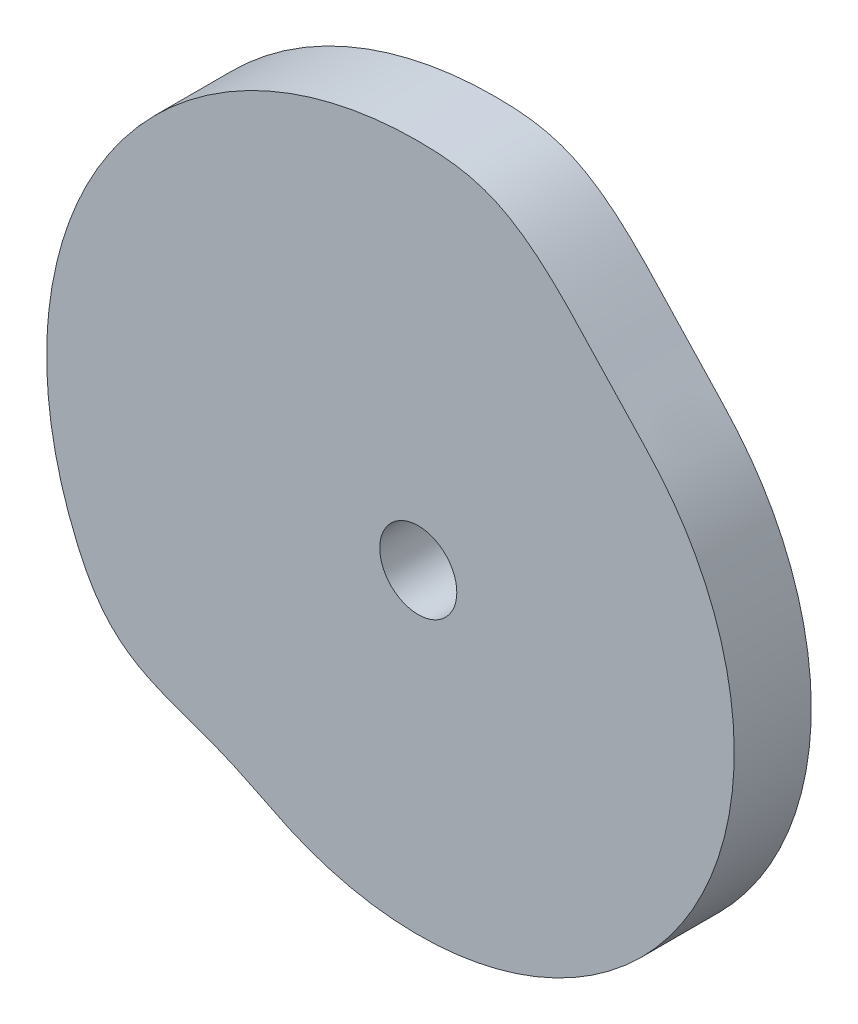
from build123d import *

# Parameters (mm, degrees)
SKETCH_1_R      = 10
EXTRUDE_1_DEPTH = 20


with BuildPart() as part:
    # 草图1 → 凸台-拉伸1 (new body)
    with BuildSketch(Plane.XY):
        with BuildLine():
            add(Edge.make_bspline(
                [(-96.4192, 2.2065), (-96.4256097, 1.92602417), (-96.436000414, 1.365018538), (-96.444383754, 0.523420306), (-96.445064054, -0.31821192), (-96.438759859, -1.159811274), (-96.424896481, -2.001341993), (-96.403852473, -2.842709617), (-96.37529793, -3.683872168), (-96.33955043, -4.524741272), (-96.296303124, -5.365302819), (-96.245826674, -6.205435948), (-96.188006636, -7.045099776), (-96.122943706, -7.884204265), (-96.050414521, -8.722731618), (-95.970587329, -9.560590416), (-95.883653194, -10.397736534), (-95.789200103, -11.234059592), (-95.68753427, -12.069529427), (-95.578480371, -12.904083402), (-95.462327614, -13.737659863), (-95.338821493, -14.570192078), (-95.207980047, -15.401612378), (-95.070036612, -16.231893216), (-94.924691106, -17.060912284), (-94.77220678, -17.888614061), (-94.612498039, -18.714945056), (-94.445587103, -19.539875335), (-94.271520335, -20.363315336), (-94.090186703, -21.185207795), (-93.901684894, -22.005465714), (-93.706088871, -22.824065879), (-93.503390945, -23.640941215), (-93.293489207, -24.455999031), (-93.076472857, -25.269185209), (-92.852473313, -26.080460729), (-92.621379982, -26.889763017), (-92.383169449, -27.697016706), (-92.138002064, -28.502170853), (-91.885633831, -29.3050621), (-91.626452596, -30.105811687), (-91.360299851, -30.904262013), (-91.087021114, -31.700324142), (-90.806958897, -32.494004183), (-90.519962365, -33.285206507), (-90.226030934, -34.073862393), (-89.925246248, -34.859923055), (-89.617622171, -35.643347487), (-89.303267353, -36.424080965), (-88.981896141, -37.20195876), (-88.654042762, -37.97686034), (-88.320017192, -38.747218226), (-87.981090891, -39.510581098), (-87.638000753, -40.264165238), (-87.290577537, -41.006151737), (-86.938702023, -41.735988711), (-86.581982957, -42.453449837), (-86.220017068, -43.158167482), (-85.852452539, -43.849947375), (-85.479076315, -44.52851969), (-85.099456031, -45.193708214), (-84.71356759, -45.845454301), (-84.320832377, -46.483539127), (-83.921272849, -47.107959063), (-83.514667883, -47.71873078), (-83.100584341, -48.315666744), (-82.679215869, -48.899098963), (-82.250029384, -49.468775041), (-81.8130492, -50.024922015), (-81.368014685, -50.56757462), (-80.915075288, -51.097132757), (-80.453691621, -51.613414796), (-79.983999687, -52.116815334), (-79.50573714, -52.607351056), (-79.018994281, -53.085409547), (-78.52338938, -53.550895147), (-78.019164166, -54.004405745), (-77.505955583, -54.445812466), (-76.983891882, -54.875527619), (-76.452912608, -55.29376076), (-75.91291106, -55.700645982), (-75.363953444, -56.096497382), (-74.806093592, -56.481582967), (-74.239282413, -56.85599171), (-73.663688807, -57.220278088), (-73.079280421, -57.574537346), (-72.486164153, -57.919184233), (-71.884438773, -58.254462089), (-71.27414606, -58.580715094), (-70.655529363, -58.898522681), (-70.028594756, -59.208000355), (-69.393634952, -59.509941322), (-68.75055839, -59.804402845), (-68.099684878, -60.092359208), (-67.441039344, -60.374068505), (-66.774838737, -60.65017426), (-66.101200069, -60.921272521), (-65.420318864, -61.188070627), (-64.732305308, -61.451181492), (-64.037322645, -61.711204913), (-63.335626536, -61.969176193), (-62.627266138, -62.22536289), (-61.912609512, -62.480962539), (-61.191898475, -62.736555619), (-60.465305408, -62.992704627), (-59.733234726, -63.250348026), (-58.9960566, -63.510233056), (-58.254153158, -63.772884502), (-57.507972284, -64.039073637), (-56.757978739, -64.309304028), (-56.00475391, -64.584209023), (-55.248797627, -64.864073377), (-54.490732338, -65.149449297), (-53.731170909, -65.440613986), (-52.970827185, -65.737851181), (-52.210199073, -66.041033495), (-51.450034035, -66.350445918), (-50.690857068, -66.665864897), (-49.933324093, -66.987222519), (-49.177887674, -67.314168801), (-48.425039923, -67.646388534), (-47.675346296, -67.983698106), (-46.929063353, -68.325343837), (-46.186643122, -68.671089382), (-45.448210726, -69.020060968), (-44.714065188, -69.371767957), (-43.984368191, -69.725598835), (-43.259320669, -70.080922572), (-42.538871466, -70.436834581), (-41.823313726, -70.792925849), (-41.112393242, -71.148019991), (-40.406378775, -71.501757844), (-39.705244132, -71.853354382), (-39.008906275, -72.201779953), (-38.317438969, -72.546382296), (-37.6310116, -72.886704793), (-36.949469366, -73.221637698), (-36.272903828, -73.550563594), (-35.601537575, -73.872938039), (-34.935342509, -74.187796768), (-34.274297643, -74.494673565), (-33.617062236, -74.793442112), (-32.961252902, -75.084754406), (-32.304510526, -75.369623263), (-31.645615273, -75.648818295), (-30.984184598, -75.921921846), (-30.320491359, -76.189476008), (-29.654459623, -76.451170168), (-28.986208742, -76.707067319), (-28.315706937, -76.957084228), (-27.643104222, -77.201291205), (-26.968309916, -77.439467396), (-26.291531811, -77.671882279), (-25.612724984, -77.898416383), (-24.931934856, -78.118863297), (-24.249280595, -78.333484095), (-23.564821333, -78.542237854), (-22.878480948, -78.744750556), (-22.190468453, -78.941555816), (-21.5007055, -79.132065642), (-20.809326485, -79.316722632), (-20.116399358, -79.495293497), (-19.421916332, -79.667842598), (-18.725933398, -79.834185122), (-18.028554142, -79.994616229), (-17.329793186, -80.148917563), (-16.62974354, -80.297141555), (-15.928358722, -80.439090069), (-15.225820307, -80.575138007), (-14.522090957, -80.704933344), (-13.817255279, -80.828521335), (-13.11135885, -80.946003332), (-12.404485001, -81.057469452), (-11.696636678, -81.162498107), (-10.987953629, -81.261540196), (-10.278424698, -81.35433085), (-9.568098561, -81.440942437), (-8.857035168, -81.521316672), (-8.145283606, -81.595577524), (-7.432908011, -81.663385414), (-6.719994267, -81.725270941), (-6.006560293, -81.780726939), (-5.292667047, -81.830028434), (-4.578376643, -81.873159134), (-3.863745803, -81.90992834), (-3.148819172, -81.94052833), (-2.433627265, -81.964964114), (-1.718264651, -81.98301571), (-1.002772071, -81.994967479), (-0.28721075, -82.0005171), (0.428383186, -81.999964278), (1.143943379, -81.993026332), (1.859403262, -81.979928145), (2.574732701, -81.960663725), (3.289857113, -81.935017072), (4.004754619, -81.903263325), (4.719345325, -81.865128742), (5.43357191, -81.82082702), (6.147371153, -81.77036288), (6.860693159, -81.71352523), (7.573520603, -81.650530643), (8.285781933, -81.581337719), (8.997408776, -81.505933123), (9.708303513, -81.424338544), (10.418462787, -81.336526176), (11.127857335, -81.242529439), (11.836419987, -81.142340989), (12.544080096, -81.035933229), (13.250732508, -80.923314816), (13.956402964, -80.804638103), (14.660986512, -80.679710002), (15.364481526, -80.548716493), (16.066820029, -80.411636828), (16.767905403, -80.268322786), (17.467716309, -80.118880863), (18.166241398, -79.963551091), (18.863352326, -79.801906946), (19.559036974, -79.634200441), (20.253233133, -79.460507823), (20.945901385, -79.280800969), (21.636972233, -79.095032537), (22.326336647, -78.903089228), (23.014037576, -78.705279236), (23.699977264, -78.501516525), (24.384131838, -78.291691475), (25.066413004, -78.075880815), (25.746810028, -77.854187398), (26.425254561, -77.626600046), (27.101635945, -77.392990534), (27.77594135, -77.153459023), (28.448188668, -76.908176805), (29.118241249, -76.65698311), (29.786090585, -76.399949952), (30.451668647, -76.1371889), (31.114912915, -75.868543175), (31.775795887, -75.594190723), (32.434218781, -75.313929599), (33.09022348, -75.028050074), (33.743722187, -74.73645484), (34.394649301, -74.439147908), (35.042923595, -74.136133705), (35.688579529, -73.827553536), (36.331427008, -73.513218971), (36.971581751, -73.19343521), (37.608900928, -72.868012186), (38.24336223, -72.537040005), (38.874906989, -72.200503323), (39.503461208, -71.858519076), (40.12906464, -71.511121147), (40.75148386, -71.158081952), (41.370936593, -70.799787443), (41.987229576, -70.436133357), (42.60024917, -70.06693622), (43.210134627, -69.692623993), (43.816661381, -69.312861488), (44.41988004, -68.927891818), (45.019621303, -68.537569704), (45.616028299, -68.142164794), (46.208864421, -67.741437761), (46.798317646, -67.335681876), (47.384069187, -66.924631879), (47.966333021, -66.508641914), (48.544898937, -66.087528153), (49.11984952, -65.66146151), (49.690905606, -65.230223906), (50.258232679, -64.794115559), (50.821781183, -64.353099972), (51.381427604, -63.907138653), (51.937145059, -63.456276932), (52.489000054, -63.000746984), (53.036653247, -62.540136275), (53.580472872, -62.075035222), (54.120085686, -61.605069282), (54.655614376, -61.130460945), (55.18699212, -60.651166022), (55.714210159, -60.16728153), (56.237103391, -59.678767049), (56.755715882, -59.185706969), (57.270143612, -58.688299166), (57.780010982, -58.18619274), (58.285683131, -57.67985948), (58.786693339, -57.168932489), (59.28337877, -56.653779779), (59.775570465, -56.134361157), (60.263047504, -55.610473661), (60.746081135, -55.082498879), (61.22445452, -54.550301748), (61.698217704, -54.013987269), (62.167151728, -53.473461072), (62.631533242, -52.929017636), (63.090861232, -52.380332298), (63.545627028, -51.827846699), (63.995539308, -51.271347578), (64.44047591, -50.710888479), (64.880534103, -50.146581644), (65.315752836, -49.578570987), (65.745812811, -49.006589682), (66.171016669, -48.431042562), (66.59120154, -47.85180241), (67.006101552, -47.268774466), (67.416183505, -46.682312391), (67.820953815, -46.092191307), (68.22055398, -45.498592061), (68.614976967, -44.901519939), (69.004275851, -44.301118008), (69.38818611, -43.697216074), (69.766890511, -43.090041299), (70.140287758, -42.479561053), (70.508273995, -41.865854279), (70.870928593, -41.248968789), (71.22819479, -40.628955964), (71.579982942, -40.005799598), (71.926448434, -39.379689813), (72.267301033, -38.750499305), (72.602713794, -38.118375912), (72.932651732, -37.483381727), (73.256906261, -36.845444614), (73.575743704, -36.204799456), (73.88882702, -35.561344406), (74.196347299, -34.915224323), (74.498239634, -34.266439716), (74.794482065, -33.615043342), (75.084829049, -32.96099351), (75.369631771, -32.304514305), (75.648816015, -31.64561426), (75.921922457, -30.984184869), (76.189475844, -30.320491286), (76.451170211, -29.654459642), (76.707067307, -28.986208737), (76.957084232, -28.315706939), (77.201291204, -27.643104221), (77.439467396, -26.968309916), (77.671882279, -26.291531811), (77.898416383, -25.612724984), (78.118863297, -24.931934856), (78.333484095, -24.249280595), (78.542237854, -23.564821333), (78.744750556, -22.878480948), (78.941555816, -22.190468453), (79.132065642, -21.5007055), (79.316722632, -20.809326485), (79.495293497, -20.116399358), (79.667842598, -19.421916332), (79.834185122, -18.725933398), (79.994616229, -18.028554142), (80.148917563, -17.329793186), (80.297141555, -16.62974354), (80.439090069, -15.928358722), (80.575138007, -15.225820307), (80.704933344, -14.522090957), (80.828521335, -13.817255279), (80.946003332, -13.11135885), (81.057469452, -12.404485001), (81.162498107, -11.696636678), (81.261540196, -10.987953629), (81.35433085, -10.278424698), (81.440942437, -9.568098561), (81.521316672, -8.857035168), (81.595577524, -8.145283606), (81.663385414, -7.432908011), (81.725270941, -6.719994267), (81.780726939, -6.006560293), (81.830028434, -5.292667047), (81.873159134, -4.578376643), (81.90992834, -3.863745803), (81.94052833, -3.148819172), (81.964964114, -2.433627265), (81.98301571, -1.718264651), (81.994967479, -1.002772071), (82.0005171, -0.28721075), (81.999964278, 0.428383186), (81.993026332, 1.143943379), (81.979928145, 1.859403262), (81.960663725, 2.574732701), (81.935017072, 3.289857113), (81.903263325, 4.004754619), (81.865128742, 4.719345325), (81.82082702, 5.43357191), (81.77036288, 6.147371153), (81.71352523, 6.860693159), (81.650530643, 7.573520603), (81.581337719, 8.285781933), (81.505933123, 8.997408776), (81.424338544, 9.708303513), (81.336526176, 10.418462787), (81.242529439, 11.127857335), (81.142340989, 11.836419987), (81.035933229, 12.544080096), (80.923314816, 13.250732508), (80.804638103, 13.956402964), (80.679710002, 14.660986512), (80.548716493, 15.364481526), (80.411636828, 16.066820029), (80.268322786, 16.767905403), (80.118880863, 17.467716309), (79.963551091, 18.166241398), (79.801906946, 18.863352326), (79.634200441, 19.559036974), (79.460507823, 20.253233133), (79.280800969, 20.945901385), (79.095032537, 21.636972233), (78.903089228, 22.326336647), (78.705279236, 23.014037576), (78.501516525, 23.699977264), (78.291691475, 24.384131838), (78.075880815, 25.066413004), (77.854187398, 25.746810028), (77.626600046, 26.425254561), (77.392990534, 27.101635945), (77.153459023, 27.77594135), (76.908176805, 28.448188668), (76.65698311, 29.118241249), (76.399949952, 29.786090585), (76.1371889, 30.451668647), (75.868543175, 31.114912915), (75.594190723, 31.775795887), (75.313929599, 32.434218781), (75.028050074, 33.09022348), (74.73645484, 33.743722187), (74.439147908, 34.394649301), (74.136133705, 35.042923595), (73.827553536, 35.688579529), (73.513218971, 36.331427008), (73.19343521, 36.971581751), (72.868012186, 37.608900928), (72.537040005, 38.24336223), (72.200503323, 38.874906989), (71.858519076, 39.503461208), (71.511121147, 40.12906464), (71.158081952, 40.75148386), (70.799787443, 41.370936593), (70.436133357, 41.987229576), (70.06693622, 42.60024917), (69.692623993, 43.210134627), (69.312861488, 43.816661381), (68.927891818, 44.41988004), (68.537569704, 45.019621303), (68.142164794, 45.616028299), (67.741437761, 46.208864421), (67.335681876, 46.798317646), (66.924631879, 47.384069187), (66.508641914, 47.966333021), (66.087528153, 48.544898938), (65.661461508, 49.119849518), (65.230223912, 49.690905611), (64.794115534, 50.258232658), (64.353100065, 50.821781262), (63.907138309, 51.38142731), (63.456278215, 51.937146157), (63.000742196, 52.488995957), (62.540002894, 53.036848386), (62.073508371, 53.582121013), (61.599230775, 54.126799811), (61.1155936, 54.673324035), (60.622056862, 55.223558711), (60.118576899, 55.777981778), (59.605409638, 56.337048404), (59.083077854, 56.901270543), (58.551782525, 57.47092773), (58.011952664, 58.046282311), (57.464067985, 58.627774979), (56.908466106, 59.215549999), (56.345572219, 59.809863209), (55.775748402, 60.410780955), (55.199447928, 61.018455859), (54.617208, 61.633084905), (54.029236124, 62.25451718), (53.435848958, 62.882672656), (52.837617518, 63.51777344), (52.234566544, 64.159397414), (51.627268084, 64.807727029), (51.01557083, 65.462141878), (50.400254775, 66.12294788), (49.780958486, 66.789356917), (49.158187144, 67.461382037), (48.53202597, 68.138582719), (47.902564956, 68.820583221), (47.269964886, 69.506972888), (46.63412738, 70.197230481), (45.995322042, 70.890915048), (45.353541262, 71.587458358), (44.7088936, 72.286299345), (44.06136995, 72.986799213), (43.411022273, 73.688342272), (42.757915988, 74.390196507), (42.102204564, 75.091806333), (41.443660314, 75.792131546), (40.78270389, 76.490769972), (40.119193487, 77.186695493), (39.453193735, 77.879103788), (38.784831182, 78.567187691), (38.114189451, 79.250131355), (37.44149759, 79.927131948), (36.76661641, 80.597149931), (36.090025153, 81.259602874), (35.411477845, 81.91333939), (34.73129528, 82.55772009), (34.049524922, 83.191783571), (33.366504738, 83.814991091), (32.68207327, 84.426138585), (31.996791369, 85.025049071), (31.310380173, 85.610509825), (30.62330733, 86.182289975), (29.935384706, 86.739354921), (29.247093359, 87.281606823), (28.558303588, 87.808207586), (27.869227095, 88.31899886), (27.179783847, 88.813323822), (26.490215376, 89.291168575), (25.800445456, 89.752150084), (25.110461149, 90.196041043), (24.420207767, 90.622841322), (23.729656987, 91.032496493), (23.038571231, 91.424943983), (22.346989697, 91.800433744), (21.654520396, 92.158805182), (20.961053485, 92.500390072), (20.266170365, 92.825204554), (19.569762965, 93.133787105), (18.871343621, 93.426141961), (18.17054983, 93.702575975), (17.466975373, 93.963366725), (16.760248637, 94.208889695), (16.049899558, 94.439368249), (15.335521865, 94.655202899), (14.616681926, 94.856827525), (13.892873401, 95.044164878), (13.163740079, 95.21807134), (12.428778193, 95.378368477), (11.687679008, 95.525908884), (10.940031813, 95.660681773), (10.18546441, 95.782944304), (9.423719259, 95.893563462), (8.654414209, 95.992413593), (7.877310775, 96.080288376), (7.092158938, 96.157202945), (6.29874266, 96.224076325), (5.496883409, 96.280889077), (4.686379154, 96.328504954), (3.867179164, 96.36721657), (3.039365018, 96.397880756), (2.204348612, 96.420403713), (1.364785653, 96.4360167), (0.523420199, 96.444380012), (-0.318211891, 96.445065057), (-1.159811281, 96.43875959), (-2.00134199, 96.424896553), (-2.842709618, 96.403852454), (-3.683872168, 96.375297935), (-4.524741272, 96.339550429), (-5.365302819, 96.296303124), (-6.205435948, 96.245826674), (-7.045099776, 96.188006636), (-7.884204265, 96.122943706), (-8.722731618, 96.050414521), (-9.560590416, 95.970587329), (-10.397736534, 95.883653194), (-11.234059592, 95.789200103), (-12.069529427, 95.68753427), (-12.904083402, 95.578480371), (-13.737659863, 95.462327614), (-14.570192078, 95.338821493), (-15.401612378, 95.207980047), (-16.231893216, 95.070036612), (-17.060912284, 94.924691106), (-17.888614061, 94.77220678), (-18.714945056, 94.612498039), (-19.539875335, 94.445587103), (-20.363315336, 94.271520335), (-21.185207795, 94.090186703), (-22.005465714, 93.901684894), (-22.824065879, 93.706088871), (-23.640941215, 93.503390945), (-24.455999031, 93.293489207), (-25.269185209, 93.076472857), (-26.080460729, 92.852473313), (-26.889763017, 92.621379982), (-27.697016705, 92.383169449), (-28.502170853, 92.138002064), (-29.3050621, 91.885633831), (-30.105811687, 91.626452596), (-30.904262013, 91.360299851), (-31.700324142, 91.087021114), (-32.494004182, 90.806958895), (-33.28520651, 90.519962372), (-34.073862383, 90.226030909), (-34.859923095, 89.92524634), (-35.643347337, 89.617621828), (-36.424081523, 89.303268635), (-37.201956676, 88.981891356), (-37.977073744, 88.65397362), (-38.749216348, 88.319070502), (-39.518484534, 87.977646234), (-40.284730744, 87.629396202), (-41.047895577, 87.274521574), (-41.80791895, 86.912996672), (-42.564780213, 86.544914748), (-43.318350724, 86.170050484), (-44.068725965, 85.788828845), (-44.815668604, 85.400976402), (-45.559198868, 85.006665586), (-46.299304831, 84.605870668), (-47.035874098, 84.198601541), (-47.768790222, 83.784839788), (-48.498150229, 83.364847386), (-49.223806183, 82.938455965), (-49.945728995, 82.505786055), (-50.663746709, 82.066678922), (-51.378070274, 81.621583297), (-52.088324964, 81.170017938), (-52.794693624, 80.712432261), (-53.496986654, 80.248596463), (-54.195251684, 79.778720861), (-54.889443925, 79.302830555), (-55.579280087, 78.820682398), (-56.265003441, 78.332662703), (-56.94653071, 77.838849251), (-57.62353426, 77.338842222), (-58.296268979, 76.83307971), (-58.964503747, 76.321352782), (-59.628399642, 75.803999124), (-60.287513352, 75.280638426), (-60.942217662, 74.751750602), (-61.592162532, 74.217039613), (-62.237491342, 73.676725006), (-62.878105899, 73.130831714), (-63.513894146, 72.579340496), (-64.14482384, 72.022288159), (-64.770902729, 71.459824747), (-65.392061365, 70.891907039), (-66.008121084, 70.31848307), (-66.619248299, 69.739766332), (-67.225332851, 69.155806754), (-67.826280568, 68.566542352), (-68.422077132, 67.972092905), (-69.012563037, 67.372334391), (-69.597890421, 66.76754923), (-70.177882234, 66.157661614), (-70.752492879, 65.542697302), (-71.321835069, 64.92285318), (-71.885569233, 64.297887552), (-72.444048364, 63.668240946), (-72.996815447, 63.0335734), (-73.544152919, 62.394192295), (-74.085812726, 61.750010802), (-74.621849836, 61.101139966), (-75.1522999, 60.447692277), (-75.676792271, 59.789439474), (-76.195822977, 59.126886597), (-76.708732747, 58.459592012), (-77.216097959, 57.788077424), (-77.717393235, 57.112008071), (-78.2127935, 56.431602385), (-78.702282915, 55.746913111), (-79.185819951, 55.05802283), (-79.663185101, 54.364870501), (-80.134656813, 53.667669684), (-80.599885247, 52.966305439), (-81.059058664, 52.26092687), (-81.51200328, 51.551596048), (-81.958782346, 50.83831961), (-82.399190562, 50.121126562), (-82.833616533, 49.400238203), (-83.261405997, 48.675415539), (-83.683092193, 47.94701487), (-84.098233249, 47.214911016), (-84.507112333, 46.479251976), (-84.909467393, 45.740008437), (-85.305347822, 44.997245164), (-85.694942012, 44.251209482), (-86.077639418, 43.50160337), (-86.454152256, 42.748874131), (-86.823742544, 41.992718671), (-87.187039812, 41.233529124), (-87.543520824, 40.471116872), (-87.893285653, 39.705584468), (-88.236552907, 38.937109092), (-88.572905883, 38.165572013), (-88.902627329, 37.391194305), (-89.225537416, 36.613963432), (-89.541621313, 35.833955962), (-89.850962183, 35.051250578), (-90.153347092, 34.265797271), (-90.448923124, 33.477767082), (-90.73766842, 32.687182933), (-91.019466147, 31.894126049), (-91.294235515, 31.098603408), (-91.562162329, 30.300746113), (-91.823183063, 29.500607159), (-92.077063458, 28.698156302), (-92.323966238, 27.893557269), (-92.563868433, 27.086824908), (-92.796790018, 26.278040618), (-93.022565616, 25.467233872), (-93.241320196, 24.654523639), (-93.452749142, 23.83988811), (-93.657295387, 23.023475964), (-93.854699569, 22.205285091), (-94.044905843, 21.385386336), (-94.227854606, 20.563868637), (-94.403854064, 19.740837675), (-94.572358879, 18.916238209), (-94.733907856, 18.090222661), (-94.888211405, 17.26286304), (-95.035204226, 16.434156605), (-95.175019786, 15.604232133), (-95.307493442, 14.773056959), (-95.43282789, 13.940801403), (-95.550777552, 13.107457613), (-95.661664856, 12.273145422), (-95.764976029, 11.437860174), (-95.86121636, 10.601737438), (-95.950155958, 9.764811923), (-96.031568356, 8.92713173), (-96.105959482, 8.088780482), (-96.172805389, 7.249807368), (-96.232412546, 6.410276401), (-96.284746844, 5.570248105), (-96.329609007, 4.729778607), (-96.367211836, 3.888947272), (-96.397542871, 3.047850656), (-96.412790551, 2.48696484), (-96.4192, 2.2065)],
                knots=[0, 0, 0, 0, 0.001504561, 0.003009115, 0.004513597, 0.006018122, 0.007522627, 0.009027224, 0.010531674, 0.012036266, 0.013540764, 0.015045453, 0.016549911, 0.018054431, 0.019558963, 0.021063608, 0.022568105, 0.024072606, 0.025577207, 0.027081668, 0.028586256, 0.030090756, 0.031595284, 0.033099927, 0.034604474, 0.036109012, 0.037613477, 0.039117985, 0.04062265, 0.042127061, 0.043631685, 0.045136245, 0.046640683, 0.048145329, 0.049649909, 0.051154317, 0.052658887, 0.054163561, 0.055668062, 0.057172557, 0.058677054, 0.06018172, 0.061686163, 0.063190777, 0.064695339, 0.066199796, 0.067704429, 0.069208956, 0.070713489, 0.072218047, 0.073722606, 0.075225825, 0.076721013, 0.07820178, 0.079666309, 0.081114756, 0.082546909, 0.083963236, 0.085363362, 0.086747909, 0.088116737, 0.089470609, 0.090809708, 0.092134774, 0.093446025, 0.094744458, 0.096030693, 0.097305393, 0.09856933, 0.099823541, 0.101068846, 0.102306155, 0.103536561, 0.104760898, 0.105980003, 0.1071951, 0.108407008, 0.109616696, 0.110825091, 0.112032983, 0.113241291, 0.114450879, 0.115662335, 0.116876369, 0.118093709, 0.119315254, 0.120541165, 0.121772369, 0.123009199, 0.124252272, 0.125502001, 0.126758595, 0.128022789, 0.129295015, 0.130575439, 0.131864497, 0.13316242, 0.134469632, 0.135786291, 0.137112754, 0.138449078, 0.139795673, 0.141152442, 0.142519482, 0.143896655, 0.145284161, 0.146681573, 0.148088574, 0.149504914, 0.150930291, 0.15236385, 0.153805024, 0.155253322, 0.156707809, 0.158167503, 0.159631469, 0.161099078, 0.162568948, 0.164040265, 0.165512073, 0.166983416, 0.168453335, 0.169920806, 0.171385108, 0.17284544, 0.174300904, 0.175750752, 0.177194542, 0.178631106, 0.180060222, 0.18148094, 0.182892865, 0.184295196, 0.185687373, 0.187068679, 0.188438481, 0.189796235, 0.19114125, 0.192472923, 0.193790278, 0.195092913, 0.196381408, 0.197662036, 0.198941299, 0.200220491, 0.201499735, 0.202778936, 0.204058124, 0.205337395, 0.206616449, 0.207895781, 0.209174865, 0.210454084, 0.211733307, 0.213012577, 0.214291706, 0.21557096, 0.216850162, 0.21812934, 0.219408664, 0.220687764, 0.221967082, 0.22324615, 0.224525415, 0.225804668, 0.227083789, 0.228363052, 0.229642169, 0.230921481, 0.232200667, 0.233479826, 0.234759086, 0.236038367, 0.237317535, 0.238596739, 0.239875876, 0.241155042, 0.242434335, 0.243713497, 0.244992786, 0.246271977, 0.247551136, 0.248830375, 0.250109611, 0.251388755, 0.252667911, 0.253947178, 0.255226468, 0.256505526, 0.257784803, 0.259064042, 0.26034316, 0.261622434, 0.262901601, 0.264180765, 0.265460015, 0.26673928, 0.268018469, 0.269297679, 0.270576842, 0.271856042, 0.273135376, 0.274414584, 0.275693765, 0.276972837, 0.278252077, 0.279531403, 0.280810561, 0.282089824, 0.283368909, 0.28464812, 0.285927345, 0.287206506, 0.288485735, 0.28976492, 0.291044118, 0.292323331, 0.293602617, 0.294881857, 0.296160975, 0.297440285, 0.298719541, 0.299998574, 0.301277871, 0.302557016, 0.303836278, 0.305115531, 0.3063947, 0.307673942, 0.308953126, 0.310232292, 0.311511595, 0.312790736, 0.314069979, 0.315349088, 0.316628327, 0.317907465, 0.319186692, 0.320465942, 0.321745149, 0.32302441, 0.324303586, 0.325582851, 0.326861985, 0.328141164, 0.329420487, 0.330699652, 0.331978913, 0.333257968, 0.334537246, 0.335816424, 0.337095687, 0.338374826, 0.339654152, 0.340933304, 0.342212532, 0.343491783, 0.344770811, 0.346050058, 0.347329275, 0.348608512, 0.349887662, 0.351166925, 0.352446148, 0.353725393, 0.355004542, 0.356283693, 0.357563052, 0.358842215, 0.360121417, 0.361400595, 0.362679891, 0.363958993, 0.365238134, 0.36651741, 0.367796668, 0.369075873, 0.370355001, 0.371634277, 0.372913413, 0.374192637, 0.375471921, 0.37675098, 0.37803029, 0.379309452, 0.380588678, 0.381867941, 0.383147086, 0.384426347, 0.385705549, 0.386984696, 0.388263841, 0.389543102, 0.390822468, 0.392101504, 0.393380809, 0.394660012, 0.395939284, 0.397218364, 0.39849764, 0.399776877, 0.401056112, 0.402335298, 0.403614382, 0.404893709, 0.406172785, 0.407452051, 0.408731357, 0.410010556, 0.411289591, 0.412568959, 0.413848114, 0.415127241, 0.416406507, 0.417685695, 0.418964903, 0.420244145, 0.421523442, 0.42280257, 0.424081705, 0.425360946, 0.42664015, 0.427919344, 0.429198607, 0.430477799, 0.431757043, 0.433036244, 0.434315432, 0.435594703, 0.436873757, 0.43815309, 0.439432173, 0.440711392, 0.441990615, 0.443269885, 0.444549014, 0.445828268, 0.44710747, 0.448386648, 0.449665972, 0.450945072, 0.45222439, 0.453503458, 0.454782723, 0.456061976, 0.457341098, 0.458620361, 0.459899477, 0.461178789, 0.462457975, 0.463737134, 0.465016394, 0.466295675, 0.467574843, 0.468854048, 0.470133184, 0.47141235, 0.472691643, 0.473970805, 0.475250095, 0.476529286, 0.477808444, 0.479087683, 0.480366919, 0.481646063, 0.48292522, 0.484204487, 0.485483776, 0.486762834, 0.488042111, 0.48932135, 0.490600469, 0.491879742, 0.49315891, 0.494438073, 0.495717323, 0.496996588, 0.498275777, 0.499554987, 0.50083415, 0.50211335, 0.503392684, 0.504671892, 0.505951073, 0.507230146, 0.508509385, 0.509788711, 0.511067869, 0.512347132, 0.513626217, 0.514905428, 0.516184653, 0.517463814, 0.518743044, 0.520022228, 0.521301426, 0.522580639, 0.523859925, 0.525139166, 0.526418283, 0.527697593, 0.528976849, 0.530255882, 0.531535179, 0.532814324, 0.534093586, 0.535372839, 0.536652008, 0.53793125, 0.539210435, 0.5404896, 0.541768903, 0.543048044, 0.544327287, 0.545606396, 0.546885636, 0.548164773, 0.549444, 0.55072325, 0.552002457, 0.553281718, 0.554560894, 0.555840159, 0.557119293, 0.558398472, 0.559677795, 0.56095696, 0.562236221, 0.563515276, 0.564794554, 0.566073732, 0.567352996, 0.568632134, 0.56991146, 0.571190612, 0.57246984, 0.573749091, 0.575028119, 0.576307367, 0.577586583, 0.57886582, 0.58014497, 0.581424233, 0.582703456, 0.583982701, 0.58526185, 0.586541001, 0.58782036, 0.589099523, 0.590378725, 0.591657903, 0.592938459, 0.59422708, 0.595531119, 0.59685224, 0.598191043, 0.599547489, 0.600922037, 0.602314486, 0.603725009, 0.605153142, 0.606599166, 0.608062599, 0.60954308, 0.611040378, 0.612554006, 0.614083467, 0.615628393, 0.617188173, 0.618762556, 0.620350672, 0.621952263, 0.623566593, 0.62519301, 0.626831142, 0.628480225, 0.630139361, 0.631808411, 0.63348621, 0.635172367, 0.636865717, 0.638565604, 0.640271241, 0.64198159, 0.64369587, 0.645412797, 0.647131713, 0.648851356, 0.650570577, 0.65228837, 0.654003619, 0.655714967, 0.657421576, 0.659121868, 0.660815041, 0.662499689, 0.664174927, 0.665839774, 0.667492756, 0.669133463, 0.670760585, 0.672373524, 0.673971664, 0.675554213, 0.677120588, 0.678670683, 0.680203864, 0.68172046, 0.683220106, 0.684702906, 0.686169491, 0.687619827, 0.689054939, 0.690475236, 0.691881718, 0.693274989, 0.694656479, 0.696027148, 0.697388348, 0.698741212, 0.700087347, 0.701428194, 0.702765014, 0.704099397, 0.705432971, 0.706766947, 0.708102989, 0.709442358, 0.710786676, 0.712136958, 0.7134946, 0.714860658, 0.716236232, 0.717622453, 0.719020134, 0.720430187, 0.721853181, 0.723290131, 0.724741167, 0.726207255, 0.727688263, 0.729183646, 0.730686956, 0.732191511, 0.733695993, 0.735200517, 0.736705022, 0.738209619, 0.739714069, 0.741218661, 0.742723159, 0.744227848, 0.745732307, 0.747236826, 0.748741359, 0.750246003, 0.7517505, 0.753255001, 0.754759602, 0.756264063, 0.757768651, 0.759273152, 0.76077768, 0.762282322, 0.763786869, 0.765291407, 0.766795873, 0.768300381, 0.769805045, 0.771309457, 0.77281408, 0.774318641, 0.775823078, 0.777327725, 0.778832304, 0.780336712, 0.781841282, 0.783345956, 0.784850457, 0.786354953, 0.787859449, 0.789364116, 0.790868558, 0.792373172, 0.793877734, 0.795382191, 0.796886824, 0.798391351, 0.799895885, 0.801400442, 0.802905001, 0.804409417, 0.805914062, 0.80741856, 0.808923187, 0.81042766, 0.811932091, 0.813436676, 0.814941369, 0.816445806, 0.81795026, 0.819454845, 0.82095952, 0.822464001, 0.823968469, 0.825473128, 0.826977692, 0.828482125, 0.829986752, 0.831491326, 0.832995772, 0.834500302, 0.83600493, 0.837509374, 0.839013953, 0.840518474, 0.84202305, 0.843527466, 0.84503202, 0.846536683, 0.84804121, 0.849545794, 0.851050218, 0.852554819, 0.854059349, 0.85556392, 0.857068511, 0.858572985, 0.860077591, 0.861582056, 0.863086619, 0.864591149, 0.866095761, 0.867600185, 0.869104791, 0.870609315, 0.872113869, 0.873618443, 0.8751229, 0.876627474, 0.87813204, 0.879636566, 0.881141063, 0.882645628, 0.88415026, 0.885654685, 0.887159268, 0.8886639, 0.890168387, 0.891672905, 0.893177502, 0.89468197, 0.896186531, 0.897691154, 0.899195704, 0.900700194, 0.902204691, 0.903709359, 0.905213766, 0.906718425, 0.908222804, 0.909727419, 0.911231924, 0.912736558, 0.914241063, 0.915745619, 0.917250031, 0.918754724, 0.920259258, 0.921763829, 0.923268306, 0.924772887, 0.926277448, 0.927781938, 0.929286478, 0.930791023, 0.932295598, 0.933800171, 0.935304766, 0.936809262, 0.938313773, 0.93981825, 0.94132274, 0.942827423, 0.944331849, 0.945836466, 0.947340995, 0.948845439, 0.95035008, 0.951854583, 0.953359117, 0.954863627, 0.956368224, 0.957872803, 0.959377306, 0.960881803, 0.962386325, 0.963890942, 0.965395552, 0.966900098, 0.968404557, 0.969909145, 0.971413698, 0.972918295, 0.974422666, 0.97592731, 0.977431784, 0.978936406, 0.980440911, 0.981945438, 0.983450054, 0.984954564, 0.986459061, 0.987963641, 0.989468097, 0.990972691, 0.992477196, 0.993981725, 0.995486382, 0.996990935, 0.998495498, 1, 1, 1, 1], degree=3))
        make_face()
        Circle(SKETCH_1_R, mode=Mode.SUBTRACT)
    extrude(amount=EXTRUDE_1_DEPTH)


solid = part.part
